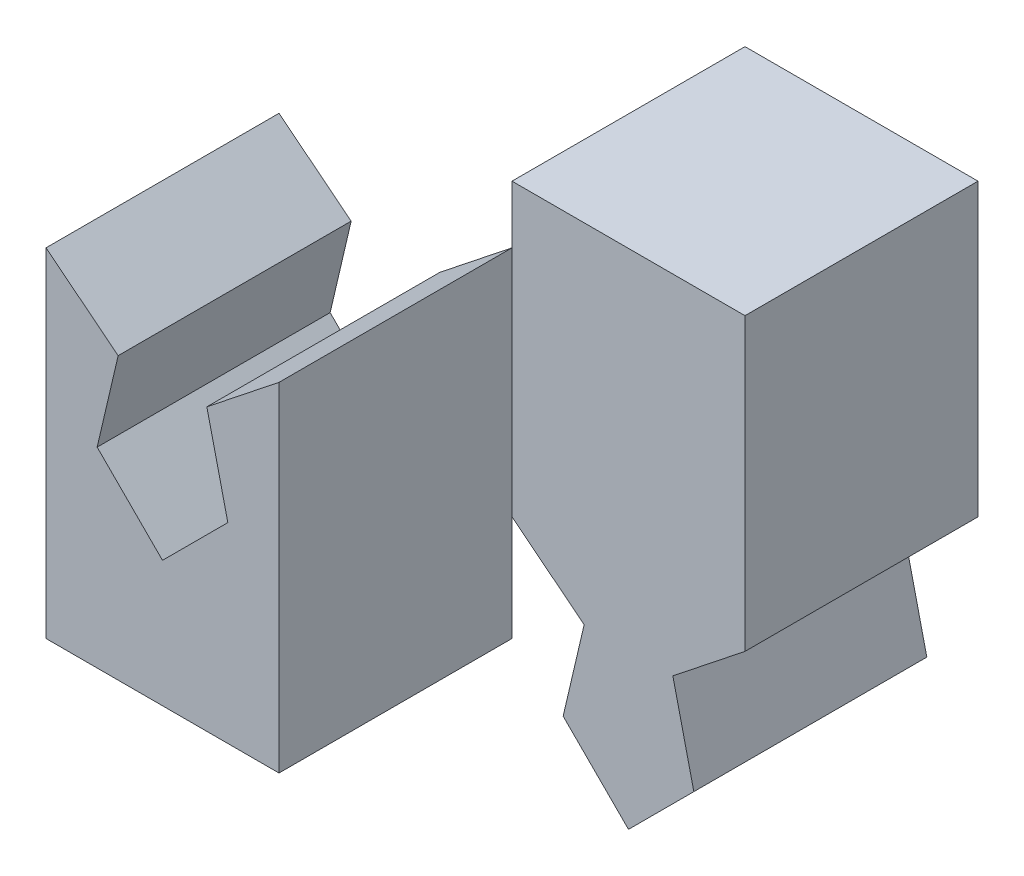
from build123d import *

# Parameters (mm, degrees)
SKETCH2_W           = 5
SKETCH2_H           = 5
BOSS_EXTRUDE1_DEPTH = 13.5
SKETCH4_W           = 5
SKETCH4_H           = 5
BOSS_EXTRUDE2_DEPTH = 13.5
CUT_EXTRUDE1_DEPTH  = 13.5


with BuildPart() as part:
    # Sketch2 → Boss-Extrude1 (new body)
    with BuildSketch(Plane(origin=(0, 0, 0), x_dir=(1, 0, 0), z_dir=(0, 1, 0))):
        Rectangle(SKETCH2_W, SKETCH2_H)
    extrude(amount=BOSS_EXTRUDE1_DEPTH)


with BuildPart() as body_2:
    # Sketch4 → Boss-Extrude2 (new body)
    with BuildSketch(Plane(origin=(0, 0, 0), x_dir=(1, 0, 0), z_dir=(0, 1, 0))):
        with Locations((10, 0)):
            Rectangle(SKETCH4_W, SKETCH4_H)
    extrude(amount=BOSS_EXTRUDE2_DEPTH)


with BuildPart() as cut_extrude1_tool:
    # Sketch5 → Cut-Extrude1 (new body)
    with BuildSketch(Plane.XY.offset(2.5)):
        Polygon((-2.5, 7.260869403), (-0.951527857, 6.031426965), (-1.402323417, 4.105300481), (0, 2.702977063), (1.402323417, 4.105300481), (0.951527857, 6.031426965), (2.5, 7.260869403), (2.5, 13.5), (-2.5, 13.5), align=None)
        Polygon((7.5, 7.260869403), (9.048472143, 6.031426965), (8.597676583, 4.105300481), (10, 2.702977063), (11.402323417, 4.105300481), (10.951527857, 6.031426965), (12.5, 7.260869403), (12.5, 0), (7.5, 0), align=None)
    extrude(amount=-CUT_EXTRUDE1_DEPTH)


with BuildPart() as part_1:
    add(part.part)

    # Cut-Extrude1: cut by cut_extrude1_tool
    add(cut_extrude1_tool.part, mode=Mode.SUBTRACT)


with BuildPart() as body_2_1:
    add(body_2.part)

    # Cut-Extrude1: cut by cut_extrude1_tool
    add(cut_extrude1_tool.part, mode=Mode.SUBTRACT)


solid = Compound([part_1.part, body_2_1.part])
